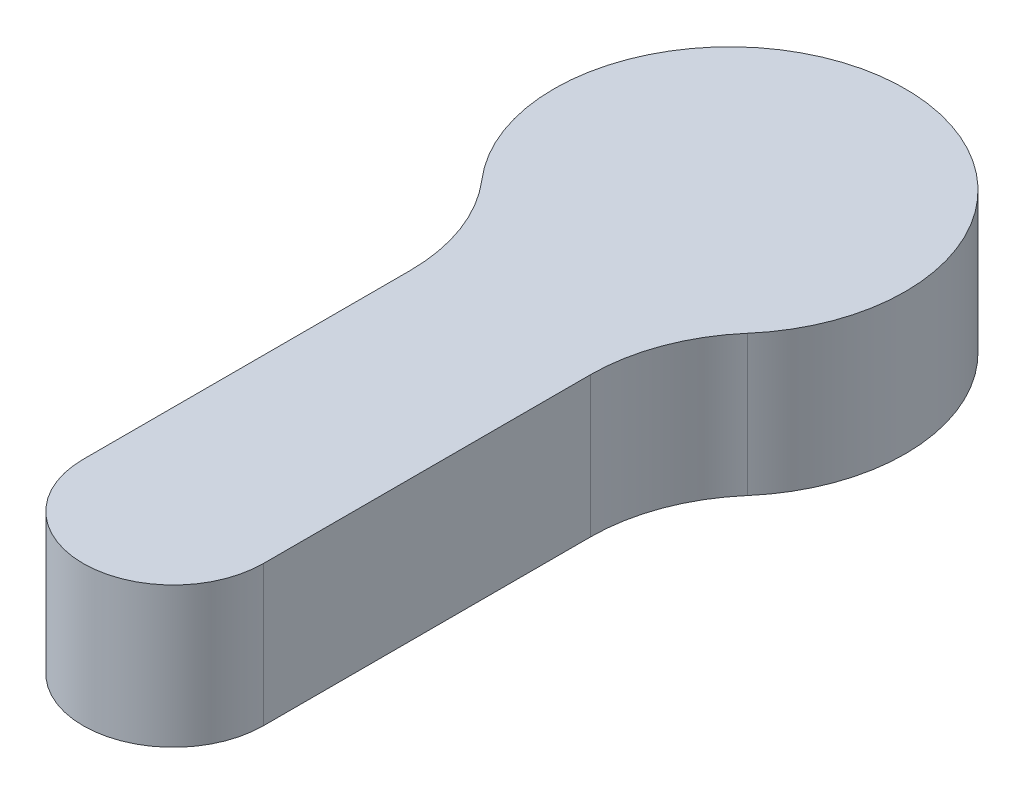
from build123d import *

# Parameters (mm, degrees)
BOSS_EXTRUDE1_DEPTH = 5.9182


with BuildPart() as part:
    # Sketch2 → Boss-Extrude1 (new body)
    with BuildSketch(Plane(origin=(0, 0, 0), x_dir=(1, 0, 0), z_dir=(0, 1, 0))):
        with BuildLine():
            Line((-3.7973, -13.765596442), (-3.7973, 0))
            ThreePointArc((-3.7973, 0), (-4.260895877, 2.571920163), (-5.593328598, 4.820101096))
            ThreePointArc((-5.593328598, 4.820101096), (0, 17.057303558), (5.593328598, 4.820101096))
            ThreePointArc((5.593328598, 4.820101096), (4.260895877, 2.571920163), (3.7973, 0))
            Line((3.7973, 0), (3.7973, -13.765596442))
            ThreePointArc((3.7973, -13.765596442), (0, -17.562896442), (-3.7973, -13.765596442))
        make_face()
    extrude(amount=BOSS_EXTRUDE1_DEPTH)


solid = part.part
